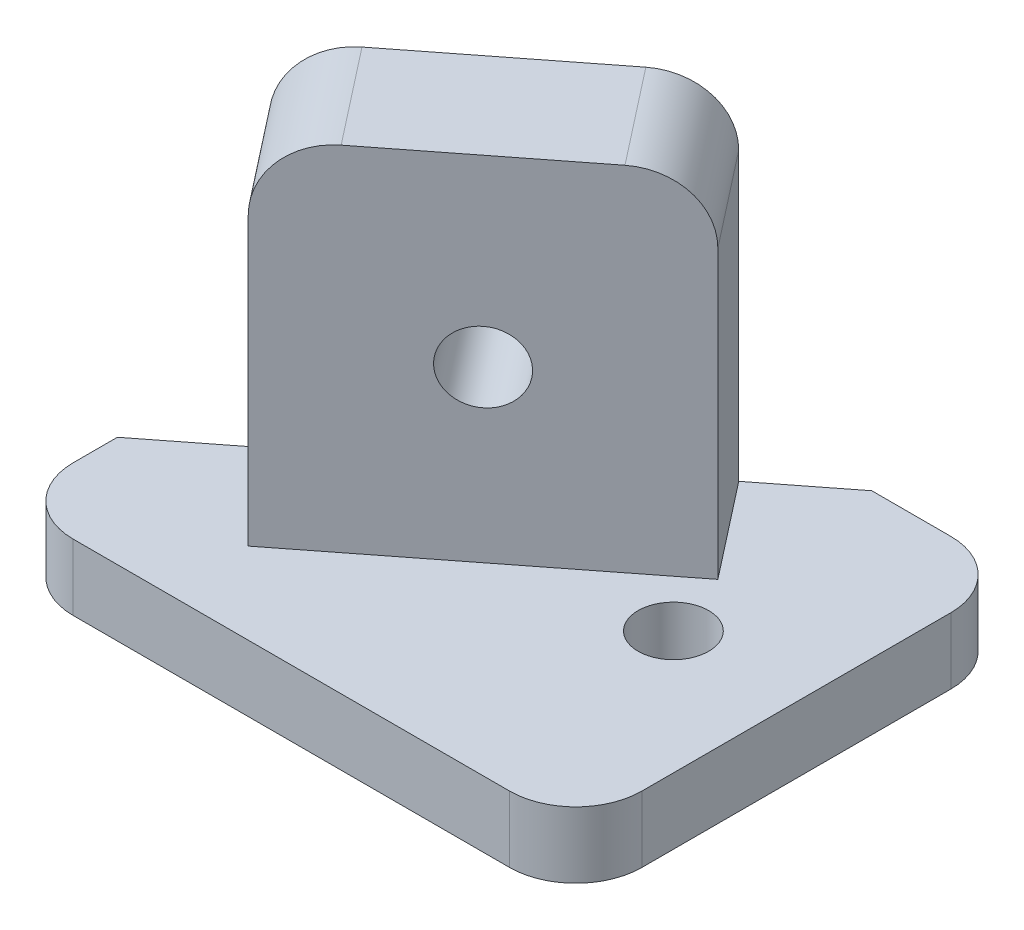
from build123d import *

# Parameters (mm, degrees)
SKETCH_1_R          = 1.6
EXTRUDE_1_DEPTH     = 3
EXTRUDE_2_DEPTH     = 16
SKETCH_4_R          = 1.6
CUT_EXTRUDE_2_DEPTH = 38.973677807
FILLET_1_R          = 3


with BuildPart() as part:
    # 草图1 → 凸台-拉伸1 (new body)
    with BuildSketch(Plane(origin=(0, 0, 0), x_dir=(1, 0, 0), z_dir=(0, 1, 0))):
        Polygon((0, 5), (19.199124483, 20), (25.779802397, 20), (25.779802397, 0), (0, 0), align=None)
        with Locations(Location((20.206855342, 10, 0), (0, 0, 270))):
            Circle(SKETCH_1_R, mode=Mode.SUBTRACT)
    extrude(amount=EXTRUDE_1_DEPTH)

    # 草图2 → 凸台-拉伸2 (add)
    with BuildSketch(Plane(origin=(0, 3, 0), x_dir=(1, 0, 0), z_dir=(0, 1, 0))):
        Polygon((3.86182986, 8.017192162), (7.239873376, 3.69349363), (19.191382346, 13.031035803), (15.81333883, 17.354734335), align=None)
    extrude(amount=EXTRUDE_2_DEPTH)

    # 草图4 → 切除-拉伸2 (cut, through all)
    with BuildSketch(Plane(origin=(-2.425739316, 0, -3.104804739), x_dir=(-0.7880107536067209, 0, 0.6156614753256597), z_dir=(-0.6156614753256597, 0, -0.7880107536067209))):
        with Locations((-15.562381102, 10.681901231)):
            Circle(SKETCH_4_R)
    extrude(amount=-CUT_EXTRUDE_2_DEPTH, mode=Mode.SUBTRACT)

    # 圆角1
    fillet_1_edges = [part.edges().sort_by_distance(p)[0] for p in [
        (5.550851618, 19, -5.855342896),
        (17.502360588, 19, -15.192885069),
        (25.779802397, 1.5, -20),
        (0, 1.5, 0),
        (25.779802397, 1.5, 0),
    ]]
    fillet(fillet_1_edges, radius=FILLET_1_R)


solid = part.part
